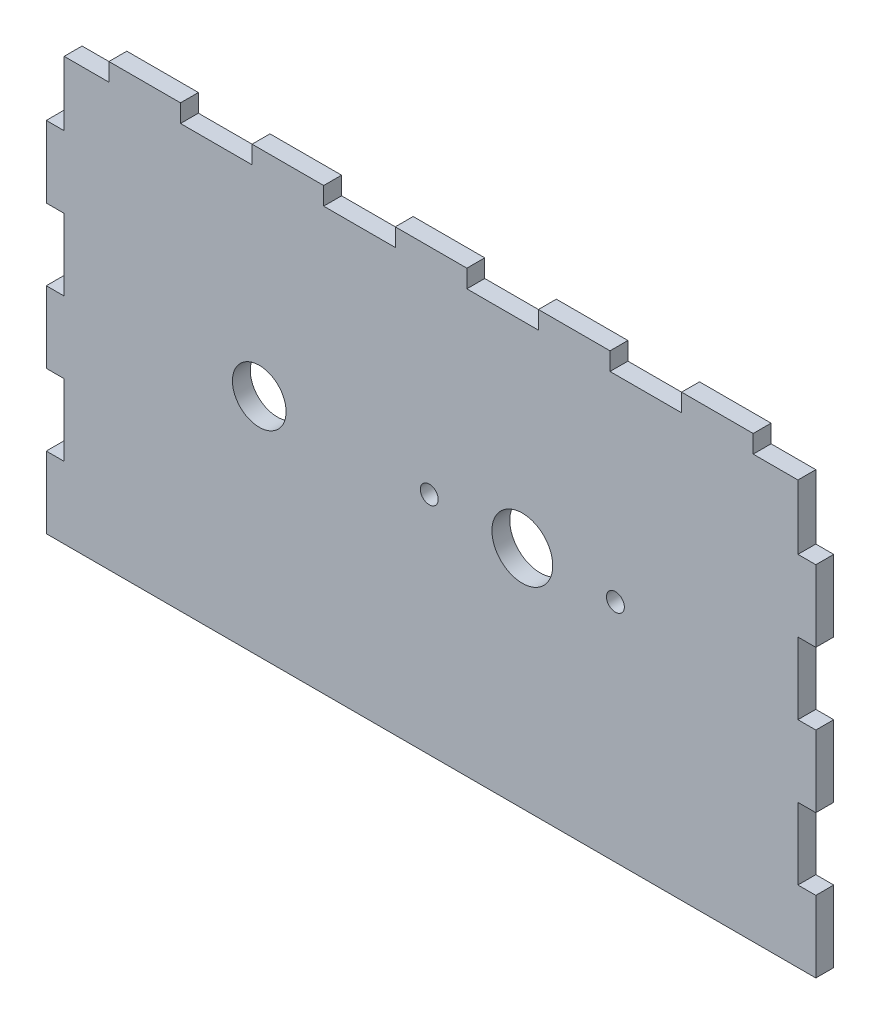
from build123d import *

# Parameters (mm, degrees)
SKETCH_1_W               = 205
SKETCH_1_H               = 118
SKETCH_1_R               = 8.5
SKETCH_1_R_2             = 7.5
SKETCH_1_R_3             = 2.5
EXTRUDE_1_DEPTH          = 5
SKETCH_2_W               = 5
SKETCH_2_H               = 20
EXTRUDE_2_DEPTH          = 5
PATTERN_LINEAR_2_COUNT   = 3
PATTERN_LINEAR_2_PITCH   = 40
MIRROR_2_COPY_1_SKETCH_W = 5
MIRROR_2_COPY_1_SKETCH_H = 20
MIRROR_2_COPY_1_DEPTH    = 5
MIRROR_2_COPY_2_SKETCH_W = 5
MIRROR_2_COPY_2_SKETCH_H = 20
MIRROR_2_COPY_2_DEPTH    = 5
SKETCH_3_W               = 20
SKETCH_3_H               = 5
EXTRUDE_3_DEPTH          = 5
PATTERN_LINEAR_3_COUNT   = 3
PATTERN_LINEAR_3_PITCH   = 40
PATTERN_LINEAR_4_COUNT   = 3
PATTERN_LINEAR_4_PITCH   = 40


with BuildPart() as part:
    # 스케치1 → 보스-돌출1 (new body)
    with BuildSketch(Plane.XY):
        Rectangle(SKETCH_1_W, SKETCH_1_H)
        with Locations((25.5, 4)):
            Circle(SKETCH_1_R, mode=Mode.SUBTRACT)
        with Locations((-48, 4)):
            Circle(SKETCH_1_R_2, mode=Mode.SUBTRACT)
        with Locations((-0.5, 4)):
            Circle(SKETCH_1_R_3, mode=Mode.SUBTRACT)
        with Locations((51.5, 4)):
            Circle(SKETCH_1_R_3, mode=Mode.SUBTRACT)
    extrude(amount=EXTRUDE_1_DEPTH)

    # 스케치2 → 보스-돌출2 (add)
    with BuildSketch(Plane.XY.offset(5)):
        with Locations((105, -49)):
            Rectangle(SKETCH_2_W, SKETCH_2_H)
    extrude_2 = extrude(amount=-EXTRUDE_2_DEPTH)

    # 선형 패턴2: 보스-돌출2 ×3
    with Locations(*[(0, i * PATTERN_LINEAR_2_PITCH, 0) for i in range(1, PATTERN_LINEAR_2_COUNT)]):
        add(extrude_2)

    # 대칭 복사2: 보스-돌출2 across plane
    add(extrude_2.mirror(Plane(origin=(0, 0, 0), x_dir=(0, 0, 1), z_dir=(1, 0, 0))))

    # 대칭 복사2 copy 1 sketch → 대칭 복사2 copy 1 (add)
    with BuildSketch(Plane(origin=(0, 40, 5), x_dir=(-1, 0, 0), z_dir=(0, 0, 1))):
        with Locations((105, 49)):
            Rectangle(MIRROR_2_COPY_1_SKETCH_W, MIRROR_2_COPY_1_SKETCH_H)
    extrude(amount=-MIRROR_2_COPY_1_DEPTH)

    # 대칭 복사2 copy 2 sketch → 대칭 복사2 copy 2 (add)
    with BuildSketch(Plane(origin=(0, 80, 5), x_dir=(-1, 0, 0), z_dir=(0, 0, 1))):
        with Locations((105, 49)):
            Rectangle(MIRROR_2_COPY_2_SKETCH_W, MIRROR_2_COPY_2_SKETCH_H)
    extrude(amount=-MIRROR_2_COPY_2_DEPTH)

    # 스케치3 → 보스-돌출3 (add)
    with BuildSketch(Plane.XY.offset(5)):
        with Locations((0, 61.5)):
            Rectangle(SKETCH_3_W, SKETCH_3_H)
    extrude_3 = extrude(amount=-EXTRUDE_3_DEPTH)

    # 선형 패턴3: 보스-돌출3 ×3
    with Locations(*[(i * PATTERN_LINEAR_3_PITCH, 0, 0) for i in range(1, PATTERN_LINEAR_3_COUNT)]):
        add(extrude_3)

    # 선형 패턴4: 보스-돌출3 ×3
    with Locations(*[(-i * PATTERN_LINEAR_4_PITCH, 0, 0) for i in range(1, PATTERN_LINEAR_4_COUNT)]):
        add(extrude_3)


solid = part.part
